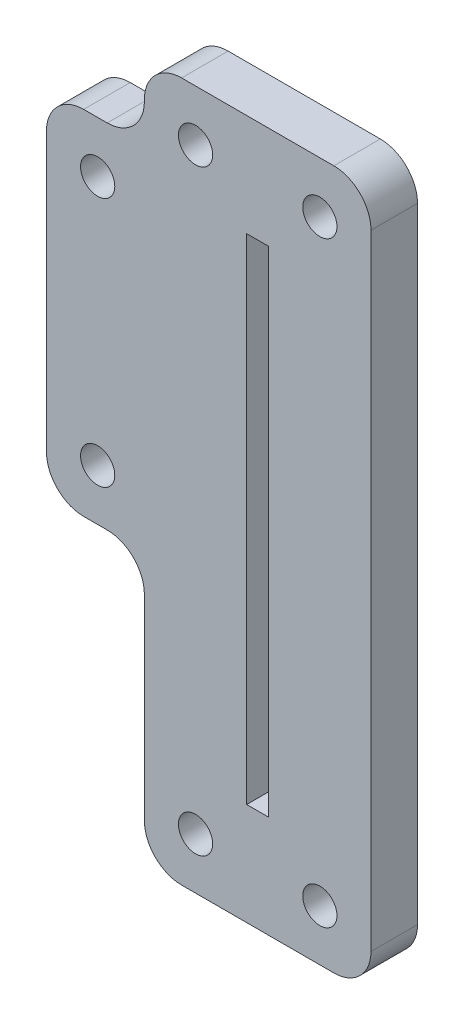
from build123d import *

# Parameters (mm, degrees)
SKETCH1_R           = 1.1684
SKETCH1_W           = 1.5
SKETCH1_H           = 33.75
BOSS_EXTRUDE1_DEPTH = 3.175


with BuildPart() as part:
    # Sketch1 → Boss-Extrude1 (new body)
    with BuildSketch(Plane.XY):
        with BuildLine():
            Line((-31.453240404, -3.582490692), (-31.453240404, -46.222490692))
            ThreePointArc((-31.453240404, -46.222490692), (-32.197189179, -48.018541916), (-33.993240404, -48.762490692))
            Line((-33.993240404, -48.762490692), (-44.383240404, -48.762490692))
            ThreePointArc((-44.383240404, -48.762490692), (-46.179291628, -48.018541916), (-46.923240404, -46.222490692))
            Line((-46.923240404, -46.222490692), (-46.923240404, -32.850740692))
            ThreePointArc((-46.923240404, -32.850740692), (-47.667189179, -31.054689467), (-49.463240404, -30.310740692))
            Line((-49.463240404, -30.310740692), (-51.065740404, -30.310740692))
            ThreePointArc((-51.065740404, -30.310740692), (-52.861791628, -29.566791916), (-53.605740404, -27.770740692))
            Line((-53.605740404, -27.770740692), (-53.605740404, -8.784240692))
            ThreePointArc((-53.605740404, -8.784240692), (-52.861791628, -6.988189467), (-51.065740404, -6.244240692))
            Line((-51.065740404, -6.244240692), (-49.463240404, -6.244240692))
            ThreePointArc((-49.463240404, -6.244240692), (-47.667189179, -5.500291916), (-46.923240404, -3.704240692))
            Line((-46.923240404, -3.704240692), (-46.923240404, -3.582490692))
            ThreePointArc((-46.923240404, -3.582490692), (-46.179291628, -1.786439467), (-44.383240404, -1.042490692))
            Line((-44.383240404, -1.042490692), (-33.993240404, -1.042490692))
            ThreePointArc((-33.993240404, -1.042490692), (-32.197189179, -1.786439467), (-31.453240404, -3.582490692))
        make_face()
        with Locations((-43.430740404, -4.534990692)):
            Circle(SKETCH1_R, mode=Mode.SUBTRACT)
        with Locations((-34.945740404, -4.534990692)):
            Circle(SKETCH1_R, mode=Mode.SUBTRACT)
        with Locations((-43.430740404, -45.269990692)):
            Circle(SKETCH1_R, mode=Mode.SUBTRACT)
        with Locations((-34.945740404, -45.269990692)):
            Circle(SKETCH1_R, mode=Mode.SUBTRACT)
        with Locations((-50.113240404, -9.736740692)):
            Circle(SKETCH1_R, mode=Mode.SUBTRACT)
        with Locations((-50.113240404, -26.818240692)):
            Circle(SKETCH1_R, mode=Mode.SUBTRACT)
        with Locations((-39.188240404, -24.902490692)):
            Rectangle(SKETCH1_W, SKETCH1_H, mode=Mode.SUBTRACT)
    extrude(amount=BOSS_EXTRUDE1_DEPTH)


solid = part.part
